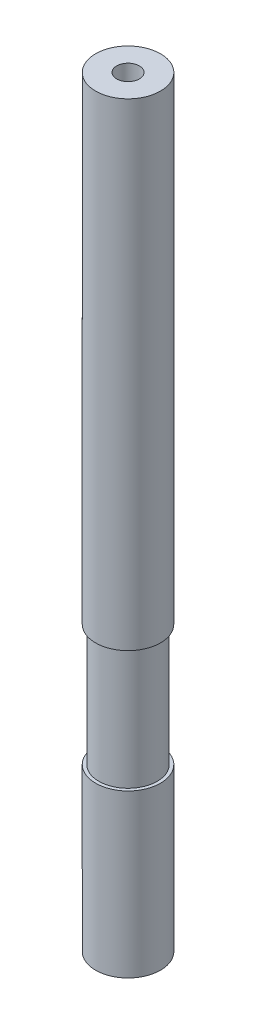
from build123d import *

# Parameters (mm, degrees)
SKETCH1_R           = 4
BOSS_EXTRUDE1_DEPTH = 47
SKETCH2_R           = 1.4
CUT_EXTRUDE1_DEPTH  = 10
CUT_EXTRUDE2_START  = -35
SKETCH3_R           = 4
SKETCH3_R_2         = 3.6
CUT_EXTRUDE2_DEPTH  = 15


with BuildPart() as part:
    # Sketch1 → Boss-Extrude1 (new, symmetric)
    with BuildSketch(Plane(origin=(0, 0, 0), x_dir=(1, 0, 0), z_dir=(0, 1, 0))):
        with Locations(Location((0, 0, 0), (0, 0, 270))):
            Circle(SKETCH1_R)
    extrude(amount=BOSS_EXTRUDE1_DEPTH, both=True)

    # Sketch2 → Cut-Extrude1 (cut)
    with BuildSketch(Plane.XZ.offset(47)):
        with Locations(Location((0, 0, 0), (0, 0, 270))):
            Circle(SKETCH2_R)
    cut_extrude1 = extrude(amount=-CUT_EXTRUDE1_DEPTH, mode=Mode.SUBTRACT)

    # Mirror1: Cut-Extrude1 across plane
    add(cut_extrude1.mirror(Plane.ZX), mode=Mode.SUBTRACT)

    # Sketch3 → Cut-Extrude2 (cut)
    with BuildSketch(Plane.XZ.offset(47).offset(CUT_EXTRUDE2_START)):
        with Locations(Location((0, 0, 0), (0, 0, 270))):
            Circle(SKETCH3_R)
        with Locations(Location((0, 0, 0), (0, 0, 270))):
            Circle(SKETCH3_R_2, mode=Mode.SUBTRACT)
    extrude(amount=CUT_EXTRUDE2_DEPTH, mode=Mode.SUBTRACT)


solid = part.part
